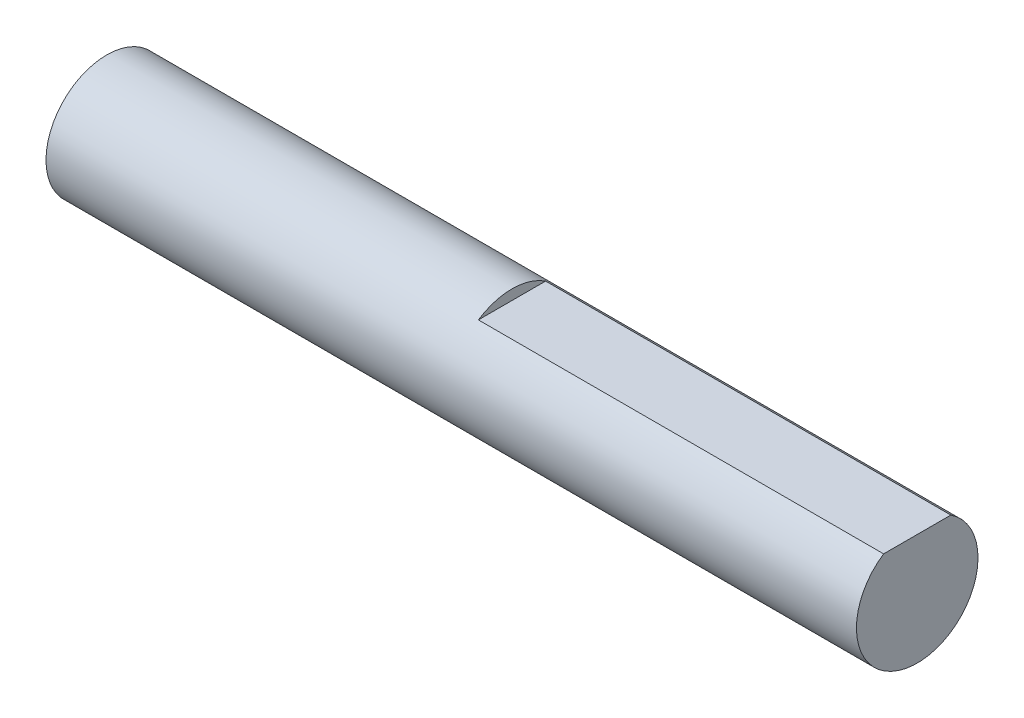
from build123d import *

# Parameters (mm, degrees)
SKETCH1_R           = 3
BOSS_EXTRUDE1_DEPTH = 40
SKETCH2_W           = 20
SKETCH2_H           = 11.151641582
CUT_EXTRUDE1_DEPTH  = 0.5


with BuildPart() as part:
    # Sketch1 → Boss-Extrude1 (new body)
    with BuildSketch(Plane(origin=(0, 0, 0), x_dir=(0, 0, -1), z_dir=(1, 0, 0))):
        Circle(SKETCH1_R)
    extrude(amount=BOSS_EXTRUDE1_DEPTH)

    # Sketch2 → Cut-Extrude1 (cut)
    with BuildSketch(Plane(origin=(0, 3, 0), x_dir=(1, 0, 0), z_dir=(0, 1, 0))):
        with Locations((30, 0.411310438)):
            Rectangle(SKETCH2_W, SKETCH2_H)
    extrude(amount=-CUT_EXTRUDE1_DEPTH, mode=Mode.SUBTRACT)


solid = part.part
